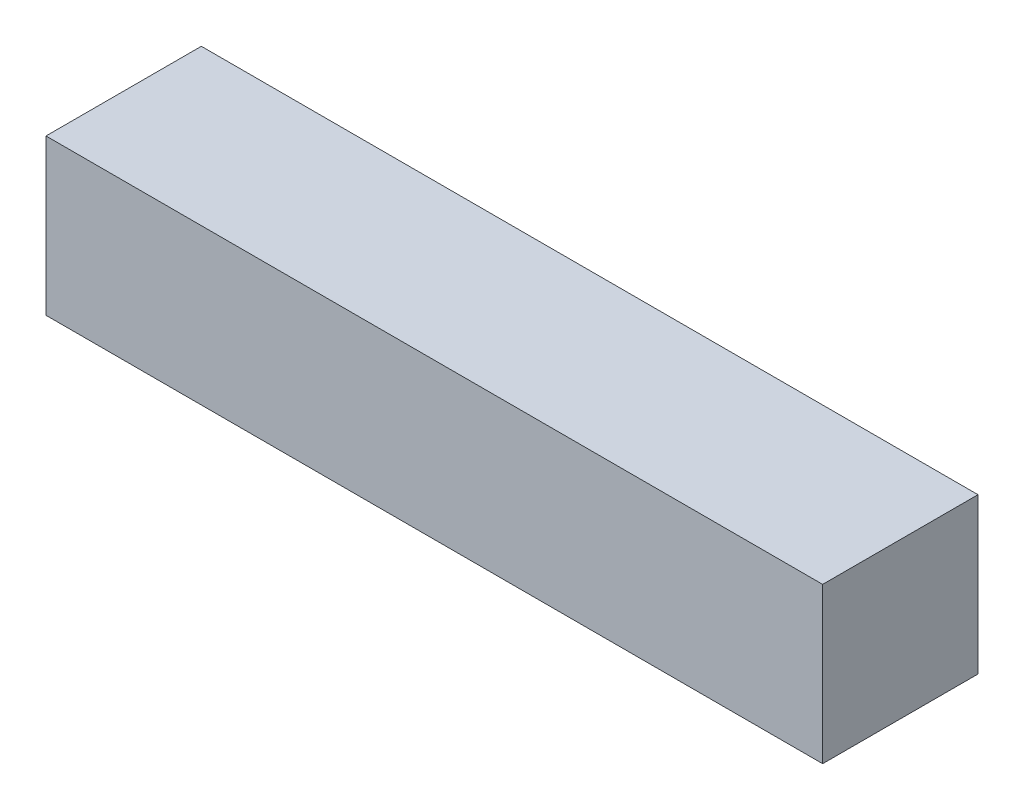
from build123d import *

# Parameters (mm, degrees)
ESQUISSE1_W        = 150
ESQUISSE1_H        = 30
BOSS_EXTRU_1_DEPTH = 30


with BuildPart() as part:
    # Esquisse1 → Boss.-Extru.1 (new body)
    with BuildSketch(Plane.XY):
        with Locations((11.148329946, 7.781569966)):
            Rectangle(ESQUISSE1_W, ESQUISSE1_H)
    extrude(amount=BOSS_EXTRU_1_DEPTH)


solid = part.part
